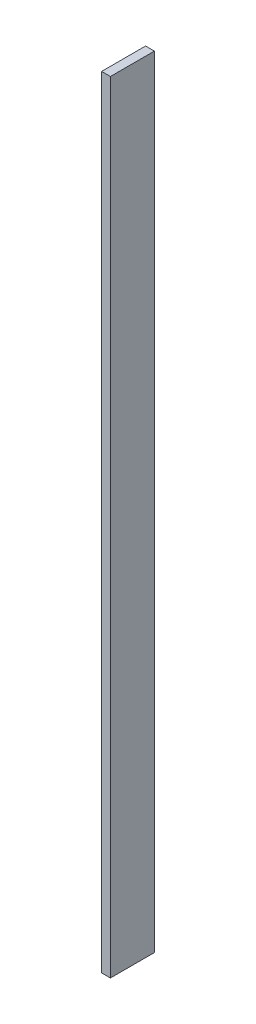
from build123d import *

# Parameters (mm, degrees)
SKETCH1_W           = 10.16
SKETCH1_H           = 50.8
BOSS_EXTRUDE1_DEPTH = 901.7


with BuildPart() as part:
    # Sketch1 → Boss-Extrude1 (new body)
    with BuildSketch(Plane(origin=(0, 0, 0), x_dir=(1, 0, 0), z_dir=(0, 1, 0))):
        with Locations((-4.891463918, 0.295993891)):
            Rectangle(SKETCH1_W, SKETCH1_H)
    extrude(amount=BOSS_EXTRUDE1_DEPTH)


solid = part.part
